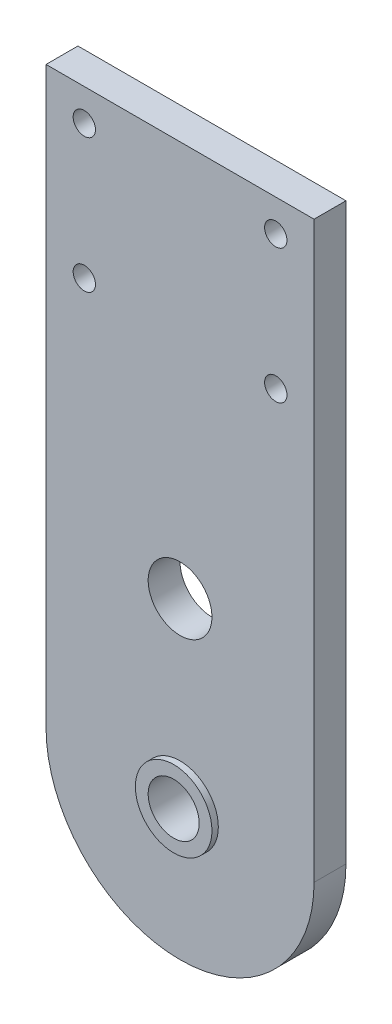
from build123d import *

# Parameters (mm, degrees)
BOSS_EXTRUDE1_DEPTH = 5
SKETCH2_R           = 1.75
CUT_EXTRUDE1_DEPTH  = 93.552687697
SKETCH3_R           = 4
CUT_EXTRUDE2_DEPTH  = 93.552687697
SKETCH4_R           = 5
CUT_EXTRUDE3_DEPTH  = 93.552687697
SKETCH6_R           = 6
SKETCH6_R_2         = 4
BOSS_EXTRUDE3_DEPTH = 1


with BuildPart() as part:
    # Sketch1 → Boss-Extrude1 (new body)
    with BuildSketch(Plane.XY):
        with BuildLine():
            Line((-21, 0), (-21, 90))
            Line((-21, 90), (21, 90))
            Line((21, 90), (21, 0))
            ThreePointArc((21, 0), (0, -21), (-21, 0))
        make_face()
    extrude(amount=BOSS_EXTRUDE1_DEPTH)

    # Sketch2 → Cut-Extrude1 (cut, through all)
    with BuildSketch(Plane(origin=(0, 0, 0), x_dir=(-1, 0, 0), z_dir=(0, 0, -1))):
        with Locations((-15, 85)):
            Circle(SKETCH2_R)
        with Locations((-15, 64)):
            Circle(SKETCH2_R)
        with Locations(Location((15, 64, 0), (0, 0, 180))):
            Circle(SKETCH2_R)
        with Locations(Location((15, 85, 0), (0, 0, 180))):
            Circle(SKETCH2_R)
    extrude(amount=-CUT_EXTRUDE1_DEPTH, mode=Mode.SUBTRACT)

    # Sketch3 → Cut-Extrude2 (cut, through all)
    with BuildSketch(Plane(origin=(0, 0, 0), x_dir=(-1, 0, 0), z_dir=(0, 0, -1))):
        Circle(SKETCH3_R)
    extrude(amount=-CUT_EXTRUDE2_DEPTH, mode=Mode.SUBTRACT)

    # Sketch4 → Cut-Extrude3 (cut, through all)
    with BuildSketch(Plane(origin=(0, 0, 0), x_dir=(-1, 0, 0), z_dir=(0, 0, -1))):
        with Locations((0, 28)):
            Circle(SKETCH4_R)
    extrude(amount=-CUT_EXTRUDE3_DEPTH, mode=Mode.SUBTRACT)

    # Sketch6 → Boss-Extrude3 (add)
    with BuildSketch(Plane.XY.offset(5)):
        Circle(SKETCH6_R)
        with Locations(Location((0, 0, 0), (0, 0, 180))):
            Circle(SKETCH6_R_2, mode=Mode.SUBTRACT)
    extrude(amount=BOSS_EXTRUDE3_DEPTH)


solid = part.part
